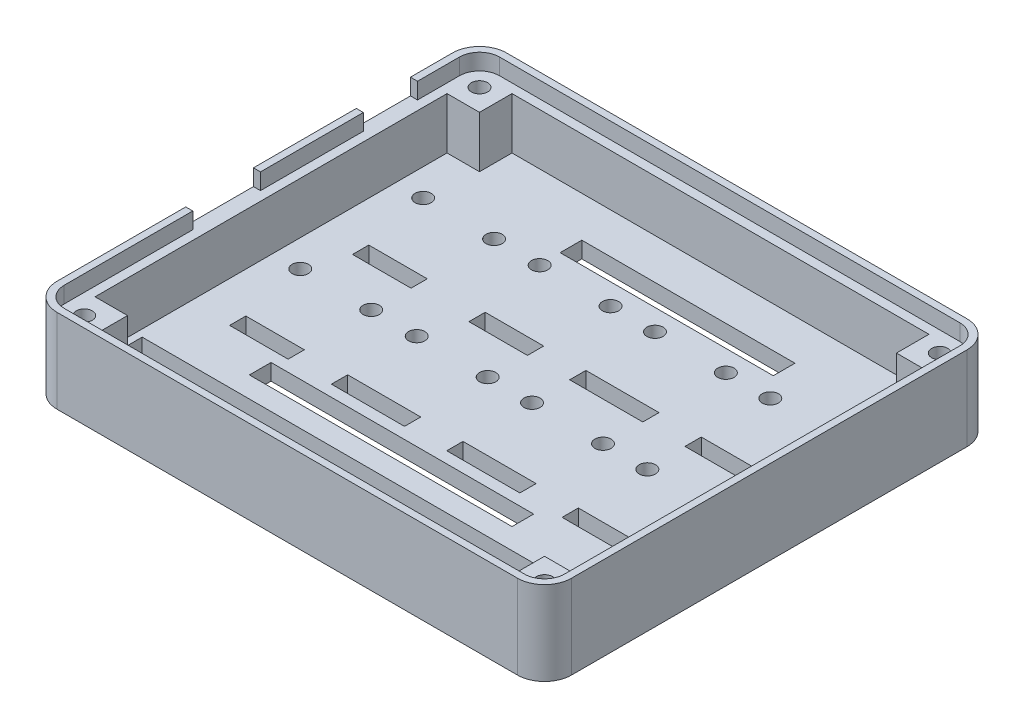
from build123d import *

# Parameters (mm, degrees)
SKETCH1_W           = 95
SKETCH1_H           = 83
BOSS_EXTRUDE1_DEPTH = 3
SKETCH3_W           = 95
SKETCH3_H           = 83
SKETCH3_W_2         = 89
SKETCH3_H_2         = 77
BOSS_EXTRUDE2_DEPTH = 9.5
SKETCH4_W           = 6
SKETCH4_H           = 6
BOSS_EXTRUDE3_DEPTH = 9.5
FILLET1_R           = 5
SKETCH5_R           = 1.5
CUT_EXTRUDE1_DEPTH  = 12.5
BOSS_EXTRUDE4_DEPTH = 3
SKETCH7_W           = 12.5
SKETCH7_H           = 3
SKETCH7_W_2         = 10
CUT_EXTRUDE2_DEPTH  = 1.3
SKETCH8_W           = 86
SKETCH8_H           = 5.5
SKETCH8_W_2         = 48.5
SKETCH8_H_2         = 4
SKETCH8_W_3         = 39.36
CUT_EXTRUDE3_DEPTH  = 3
SKETCH10_W          = 10.8
SKETCH10_H          = 3
SKETCH10_W_2        = 13.5
CUT_EXTRUDE4_DEPTH  = 3
SKETCH11_R          = 1.5
CUT_EXTRUDE5_DEPTH  = 3


with BuildPart() as part:
    # Sketch1 → Boss-Extrude1 (new body)
    with BuildSketch(Plane(origin=(0, 0, 0), x_dir=(1, 0, 0), z_dir=(0, 1, 0))):
        with Locations((47.5, 41.5)):
            Rectangle(SKETCH1_W, SKETCH1_H)
    extrude(amount=BOSS_EXTRUDE1_DEPTH)

    # Sketch3 → Boss-Extrude2 (add)
    with BuildSketch(Plane(origin=(0, 3, 0), x_dir=(1, 0, 0), z_dir=(0, 1, 0))):
        with Locations((47.5, 41.5)):
            Rectangle(SKETCH3_W, SKETCH3_H)
        with Locations((47.5, 41.5)):
            Rectangle(SKETCH3_W_2, SKETCH3_H_2, mode=Mode.SUBTRACT)
    extrude(amount=BOSS_EXTRUDE2_DEPTH)

    # Sketch4 → Boss-Extrude3 (add)
    with BuildSketch(Plane(origin=(0, 3, 0), x_dir=(1, 0, 0), z_dir=(0, 1, 0))):
        with Locations((6, 77)):
            Rectangle(SKETCH4_W, SKETCH4_H)
        with Locations((6, 6)):
            Rectangle(SKETCH4_W, SKETCH4_H)
        with Locations((89, 6)):
            Rectangle(SKETCH4_W, SKETCH4_H)
        with Locations((89, 77)):
            Rectangle(SKETCH4_W, SKETCH4_H)
    extrude(amount=BOSS_EXTRUDE3_DEPTH)

    # Fillet1
    fillet1_edges = [part.edges().sort_by_distance(p)[0] for p in [
        (0, 6.25, -83),
        (95, 6.25, -83),
        (95, 6.25, 0),
        (0, 6.25, 0),
    ]]
    fillet(fillet1_edges, radius=FILLET1_R)

    # Sketch5 → Cut-Extrude1 (cut)
    with BuildSketch(Plane(origin=(0, 12.5, 0), x_dir=(1, 0, 0), z_dir=(0, 1, 0))):
        with Locations(Location((5, 78, 0), (0, 0, 270))):
            Circle(SKETCH5_R)
        with Locations(Location((90, 78, 0), (0, 0, 270))):
            Circle(SKETCH5_R)
        with Locations(Location((90, 5, 0), (0, 0, 270))):
            Circle(SKETCH5_R)
        with Locations(Location((5, 5, 0), (0, 0, 270))):
            Circle(SKETCH5_R)
    extrude(amount=-CUT_EXTRUDE1_DEPTH, mode=Mode.SUBTRACT)

    # Sketch6 → Boss-Extrude4 (add)
    with BuildSketch(Plane(origin=(0, 12.5, 0), x_dir=(1, 0, 0), z_dir=(0, 1, 0))):
        with BuildLine():
            Line((5, 0), (90, 0))
            ThreePointArc((90, 0), (93.535533906, 1.464466094), (95, 5))
            Line((95, 5), (95, 78))
            ThreePointArc((95, 78), (93.535533906, 81.535533906), (90, 83))
            Line((90, 83), (5, 83))
            ThreePointArc((5, 83), (1.464466094, 81.535533906), (0, 78))
            Line((0, 78), (0, 5))
            ThreePointArc((0, 5), (1.464466094, 1.464466094), (5, 0))
        make_face()
        with BuildLine():
            Line((5, 1.3), (90, 1.3))
            ThreePointArc((90, 1.3), (92.61629509, 2.38370491), (93.7, 5))
            Line((93.7, 5), (93.7, 78))
            ThreePointArc((93.7, 78), (92.61629509, 80.61629509), (90, 81.7))
            Line((90, 81.7), (5, 81.7))
            ThreePointArc((5, 81.7), (2.38370491, 80.61629509), (1.3, 78))
            Line((1.3, 78), (1.3, 5))
            ThreePointArc((1.3, 5), (2.38370491, 2.38370491), (5, 1.3))
        make_face(mode=Mode.SUBTRACT)
    extrude(amount=BOSS_EXTRUDE4_DEPTH)

    # Sketch7 → Cut-Extrude2 (cut)
    with BuildSketch(Plane.ZY):
        with Locations((-35, 14)):
            Rectangle(SKETCH7_W, SKETCH7_H)
        with Locations((-65.25, 14)):
            Rectangle(SKETCH7_W_2, SKETCH7_H)
    extrude(amount=-CUT_EXTRUDE2_DEPTH, mode=Mode.SUBTRACT)

    # Sketch8 → Cut-Extrude3 (cut)
    with BuildSketch(Plane.XZ):
        with Locations((47.3, -13.65)):
            Rectangle(SKETCH8_W, SKETCH8_H)
        with Locations((44.5, -22.25)):
            Rectangle(SKETCH8_W_2, SKETCH8_H_2)
        with Locations((49.07, -70.5)):
            Rectangle(SKETCH8_W_3, SKETCH8_H_2)
    extrude(amount=-CUT_EXTRUDE3_DEPTH, mode=Mode.SUBTRACT)

    # Sketch10 → Cut-Extrude4 (cut)
    with BuildSketch(Plane.XZ):
        with Locations((15.9, -27.85)):
            Rectangle(SKETCH10_W, SKETCH10_H)
        with Locations((36.05, -27.85)):
            Rectangle(SKETCH10_W_2, SKETCH10_H)
        with Locations((57.35, -27.85)):
            Rectangle(SKETCH10_W_2, SKETCH10_H)
        with Locations((78.65, -27.85)):
            Rectangle(SKETCH10_W_2, SKETCH10_H)
        with Locations((15.9, -50.55)):
            Rectangle(SKETCH10_W, SKETCH10_H)
        with Locations((37.4, -50.55)):
            Rectangle(SKETCH10_W, SKETCH10_H)
        with Locations((57.35, -50.55)):
            Rectangle(SKETCH10_W_2, SKETCH10_H)
        with Locations((78.65, -50.55)):
            Rectangle(SKETCH10_W_2, SKETCH10_H)
    extrude(amount=-CUT_EXTRUDE4_DEPTH, mode=Mode.SUBTRACT)

    # Sketch11 → Cut-Extrude5 (cut)
    with BuildSketch(Plane.XZ):
        with Locations(Location((8, -41.9, 0), (0, 0, 270))):
            Circle(SKETCH11_R)
        with Locations(Location((21.1, -41.9, 0), (0, 0, 270))):
            Circle(SKETCH11_R)
        with Locations(Location((29.5, -41.9, 0), (0, 0, 270))):
            Circle(SKETCH11_R)
        with Locations(Location((42.6, -41.9, 0), (0, 0, 270))):
            Circle(SKETCH11_R)
        with Locations(Location((50.8, -41.9, 0), (0, 0, 270))):
            Circle(SKETCH11_R)
        with Locations(Location((63.9, -41.9, 0), (0, 0, 270))):
            Circle(SKETCH11_R)
        with Locations(Location((72.1, -41.9, 0), (0, 0, 270))):
            Circle(SKETCH11_R)
        with Locations(Location((85.2, -41.9, 0), (0, 0, 270))):
            Circle(SKETCH11_R)
        with Locations(Location((85.2, -64.6, 0), (0, 0, 270))):
            Circle(SKETCH11_R)
        with Locations(Location((72.1, -64.6, 0), (0, 0, 270))):
            Circle(SKETCH11_R)
        with Locations(Location((63.9, -64.6, 0), (0, 0, 270))):
            Circle(SKETCH11_R)
        with Locations(Location((50.8, -64.6, 0), (0, 0, 270))):
            Circle(SKETCH11_R)
        with Locations(Location((42.6, -64.6, 0), (0, 0, 270))):
            Circle(SKETCH11_R)
        with Locations(Location((29.5, -64.6, 0), (0, 0, 270))):
            Circle(SKETCH11_R)
        with Locations(Location((21.1, -64.6, 0), (0, 0, 270))):
            Circle(SKETCH11_R)
        with Locations(Location((8, -64.6, 0), (0, 0, 270))):
            Circle(SKETCH11_R)
    extrude(amount=-CUT_EXTRUDE5_DEPTH, mode=Mode.SUBTRACT)


solid = part.part
